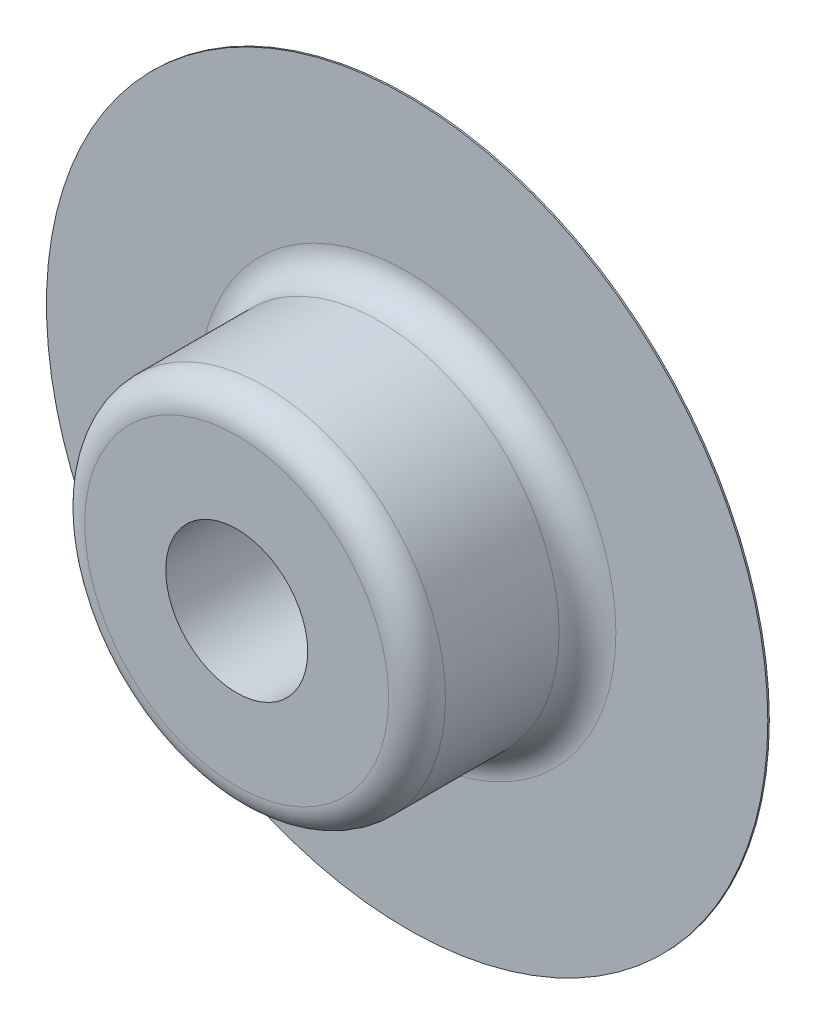
from build123d import *

# Parameters (mm, degrees)
SZKIC1_R                        = 12.7
DODANIE_WYCI_GNI_CIE1_DEPTH     = 0.054
SZKIC2_R                        = 6.35
DODANIE_WYCI_GNI_CIE2_DEPTH     = 6
WYTNIJ_WYCI_GNI_CIE1_DEPTH      = 19.953387982
WYTNIJ_WYCI_GNI_CIE1_DEPTH_BACK = 19.953387982
SZKIC3_R                        = 2.5
ZAOKR_GLENIE2_R                 = 1


with BuildPart() as part:
    # Szkic1 → Dodanie-wyciągnięcie1 (new body)
    with BuildSketch(Plane.XY):
        Circle(SZKIC1_R)
    extrude(amount=DODANIE_WYCI_GNI_CIE1_DEPTH)

    # Szkic2 → Dodanie-wyciągnięcie2 (add)
    with BuildSketch(Plane.XY.offset(0.054)):
        Circle(SZKIC2_R)
    extrude(amount=DODANIE_WYCI_GNI_CIE2_DEPTH)

    # Szkic3 → Wytnij-wyciągnięcie1 (cut, two sides: drawn at the far end of the back side and taken through both)
    with BuildSketch(Plane.XY.offset(6.054).offset(-WYTNIJ_WYCI_GNI_CIE1_DEPTH_BACK)):
        Circle(SZKIC3_R)
    extrude(amount=WYTNIJ_WYCI_GNI_CIE1_DEPTH + WYTNIJ_WYCI_GNI_CIE1_DEPTH_BACK, mode=Mode.SUBTRACT)

    # Zaokrąglenie2
    zaokr_glenie2_edges = [part.edges().sort_by_distance(p)[0] for p in [
        (-6.35, 0, 0.054),
        (-6.35, 0, 6.054),
    ]]
    fillet(zaokr_glenie2_edges, radius=ZAOKR_GLENIE2_R)


solid = part.part
